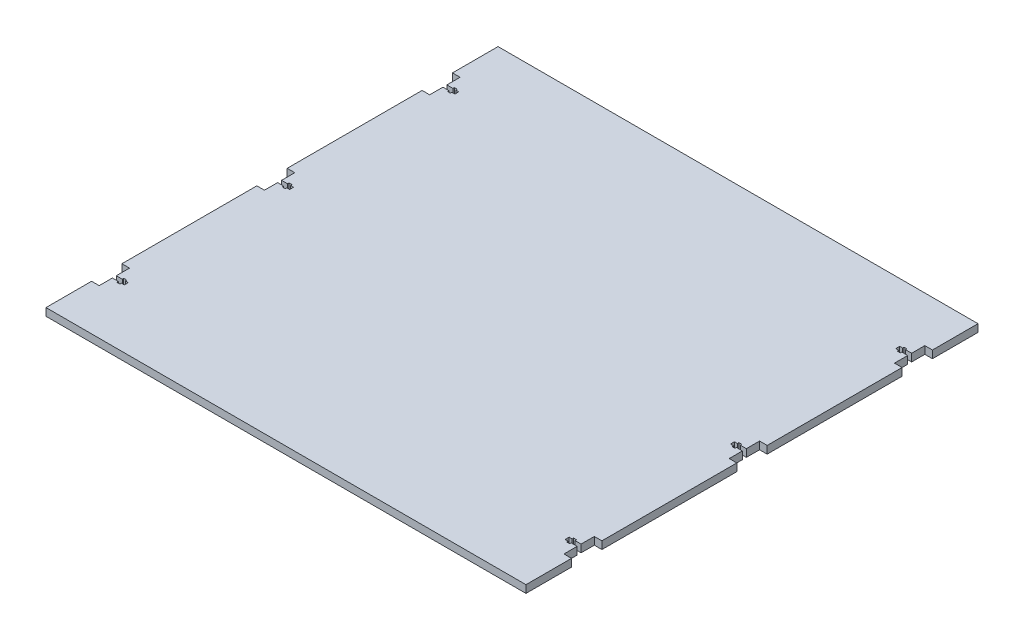
from build123d import *

# Parameters (mm, degrees)
BOSS_EXTRUDE1_DEPTH = 6.35


with BuildPart() as part:
    # Sketch1 → Boss-Extrude1 (new body)
    with BuildSketch(Plane(origin=(0, 0, -215.916475579), x_dir=(-1, 0, 0), z_dir=(0, 1, 0))):
        Polygon((1.15, 250.633169195), (-1.35, 250.633169195), (-1.35, 251.833169195), (-6.35, 251.833169195), (-6.35, 240.783169195), (-12.7, 240.783169195), (-12.7, 127.993502461), (-6.35, 127.993502461), (-6.35, 116.943502461), (-1.35, 116.943502461), (-1.35, 118.143502461), (1.15, 118.143502461), (1.15, 116.943502461), (3.65, 116.943502461), (3.65, 113.643502461), (1.15, 113.643502461), (1.15, 112.443502461), (-1.35, 112.443502461), (-1.35, 113.643502461), (-6.35, 113.643502461), (-6.35, 102.593502461), (-12.7, 102.593502461), (-12.7, -10.196164273), (-6.35, -10.196164273), (-6.35, -21.246164273), (-1.35, -21.246164273), (-1.35, -20.046164273), (1.15, -20.046164273), (1.15, -21.246164273), (3.65, -21.246164273), (3.65, -24.546164273), (1.15, -24.546164273), (1.15, -25.746164273), (-1.35, -25.746164273), (-1.35, -24.546164273), (-6.35, -24.546164273), (-6.35, -35.596164273), (-12.7, -35.596164273), (-12.7, -73.696164273), (388.62, -73.696164273), (388.62, -35.596164273), (382.27, -35.596164273), (382.27, -24.546164273), (377.27, -24.546164273), (377.27, -25.746164273), (374.77, -25.746164273), (374.77, -24.546164273), (372.27, -24.546164273), (372.27, -21.246164273), (374.77, -21.246164273), (374.77, -20.046164273), (377.27, -20.046164273), (377.27, -21.246164273), (382.27, -21.246164273), (382.27, -10.196164273), (388.62, -10.196164273), (388.62, 102.593502461), (382.27, 102.593502461), (382.27, 113.643502461), (377.27, 113.643502461), (377.27, 112.443502461), (374.77, 112.443502461), (374.77, 113.643502461), (372.27, 113.643502461), (372.27, 116.943502461), (374.77, 116.943502461), (374.77, 118.143502461), (377.27, 118.143502461), (377.27, 116.943502461), (382.27, 116.943502461), (382.27, 127.993502461), (388.62, 127.993502461), (388.62, 240.783169195), (382.27, 240.783169195), (382.27, 251.833169195), (377.27, 251.833169195), (377.27, 250.633169195), (374.77, 250.633169195), (374.77, 251.833169195), (372.27, 251.833169195), (372.27, 255.133169195), (374.77, 255.133169195), (374.77, 256.333169195), (377.27, 256.333169195), (377.27, 255.133169195), (382.27, 255.133169195), (382.27, 266.183169195), (388.62, 266.183169195), (388.62, 304.283169195), (-12.7, 304.283169195), (-12.7, 266.183169195), (-6.35, 266.183169195), (-6.35, 255.133169195), (-1.35, 255.133169195), (-1.35, 256.333169195), (1.15, 256.333169195), (1.15, 255.133169195), (3.65, 255.133169195), (3.65, 251.833169195), (1.15, 251.833169195), align=None)
    extrude(amount=-BOSS_EXTRUDE1_DEPTH)


solid = part.part
